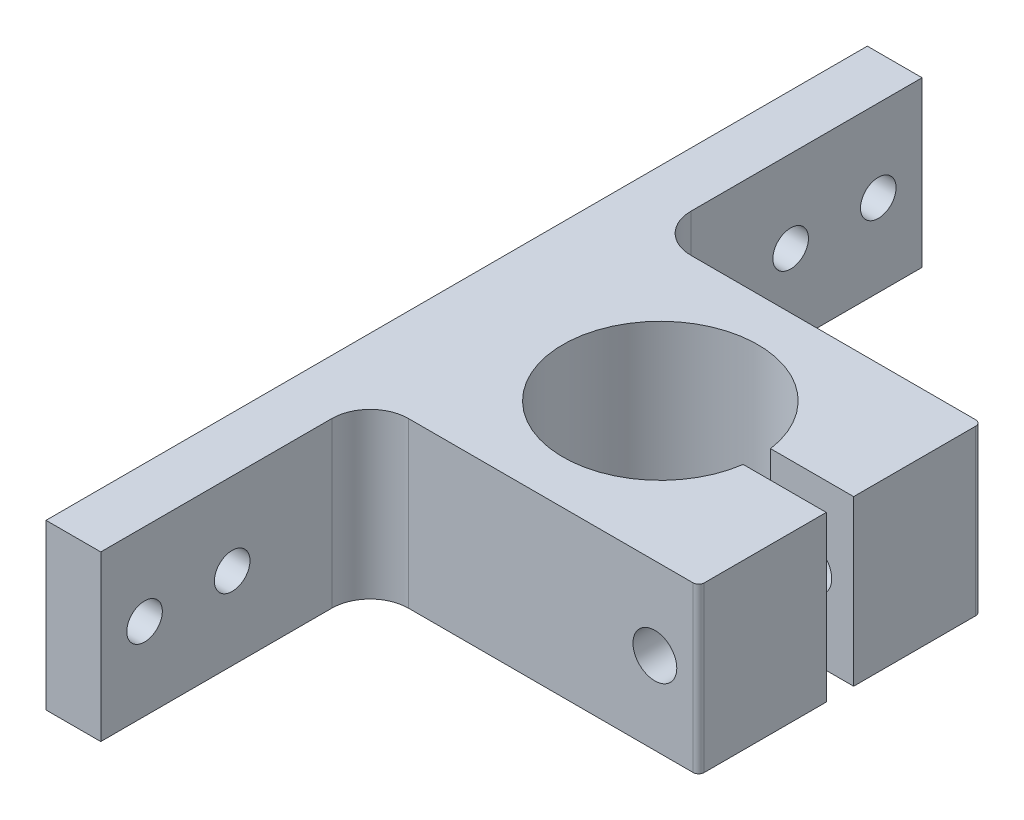
from build123d import *

# Parameters (mm, degrees)
SKETCH4_R                        = 17.8
BOSS_EXTRUDE2_DEPTH              = 30
SKETCH6_W                        = 21.036522063
SKETCH6_H                        = 5
CUT_EXTRUDE3_DEPTH               = 107.887791632
SKETCH7_R                        = 4
KIRISTYSRUUVI_M8_DEPTH           = 127.335426544
SKETCH9_R                        = 3.25
PROFIILN_KIINNITYSREI_T_M6_DEPTH = 101.623058987
FILLET1_R                        = 7
FILLET2_R                        = 1


with BuildPart() as part:
    # Sketch4 → Boss-Extrude2 (new body)
    with BuildSketch(Plane(origin=(0, 0, 0), x_dir=(1, 0, 0), z_dir=(0, 1, 0))):
        Polygon((0, 75), (10, 75), (10, 25.8), (70, 25.8), (70, -25.8), (10, -25.8), (10, -75), (0, -75), align=None)
        with Locations(Location((37.2, 0, 0), (0, 0, 270))):
            Circle(SKETCH4_R, mode=Mode.SUBTRACT)
    extrude(amount=BOSS_EXTRUDE2_DEPTH)

    # Sketch6 → Cut-Extrude3 (cut, through all)
    with BuildSketch(Plane(origin=(0, 30, 0), x_dir=(1, 0, 0), z_dir=(0, 1, 0))):
        with Locations((59.481738968, 0)):
            Rectangle(SKETCH6_W, SKETCH6_H)
    extrude(amount=-CUT_EXTRUDE3_DEPTH, mode=Mode.SUBTRACT)

    # Sketch7 → Kiristysruuvi M8 (cut, through all)
    with BuildSketch(Plane.XY.offset(25.8)):
        with Locations((62, 15)):
            Circle(SKETCH7_R)
    extrude(amount=-KIRISTYSRUUVI_M8_DEPTH, mode=Mode.SUBTRACT)

    # Sketch9 → Profiiln kiinnitysreiät M6 (cut, through all)
    with BuildSketch(Plane(origin=(10, 0, 0), x_dir=(0, 0, -1), z_dir=(1, 0, 0))):
        with Locations((-67, 15)):
            Circle(SKETCH9_R)
        with Locations((-51, 15)):
            Circle(SKETCH9_R)
        with Locations(Location((67, 15, 0), (0, 0, 180))):
            Circle(SKETCH9_R)
        with Locations(Location((51, 15, 0), (0, 0, 180))):
            Circle(SKETCH9_R)
    extrude(amount=-PROFIILN_KIINNITYSREI_T_M6_DEPTH, mode=Mode.SUBTRACT)

    # Fillet1
    fillet1_edges = [part.edges().sort_by_distance(p)[0] for p in [
        (10, 15, -25.8),
        (10, 15, 25.8),
    ]]
    fillet(fillet1_edges, radius=FILLET1_R)

    # Fillet2
    fillet2_edges = [part.edges().sort_by_distance(p)[0] for p in [
        (70, 15, -25.8),
        (70, 15, 25.8),
    ]]
    fillet(fillet2_edges, radius=FILLET2_R)


solid = part.part
